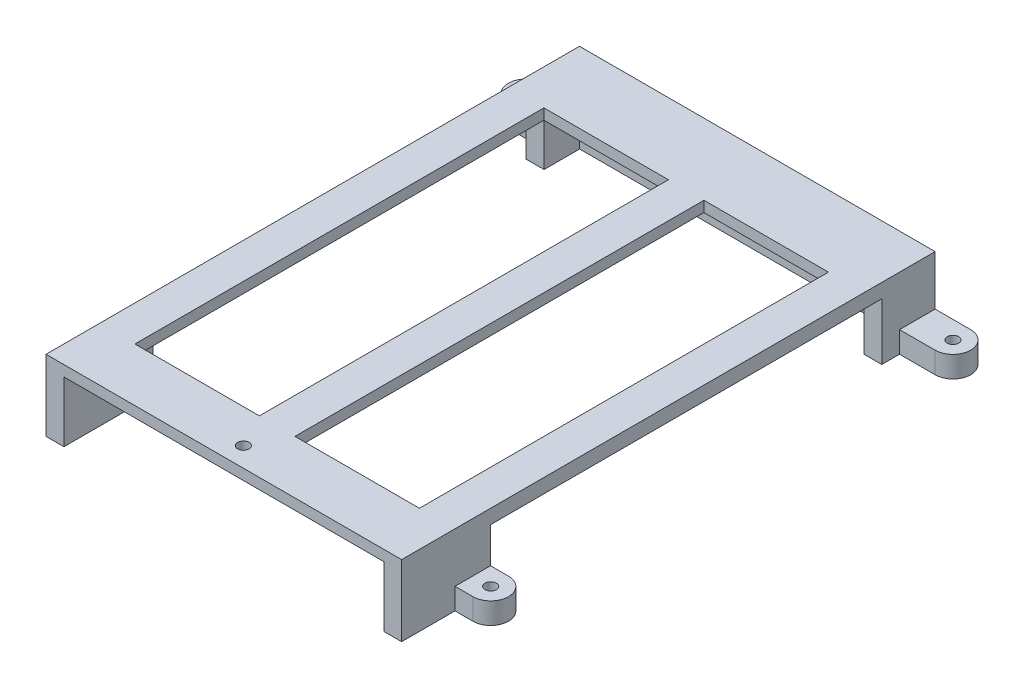
from build123d import *

# Parameters (mm, degrees)
SKETCH_2_W          = 100
SKETCH_2_H          = 40
EXTRUDE_1_DEPTH     = 150
SKETCH_3_W          = 90
SKETCH_3_H          = 32
CUT_EXTRUDE_1_DEPTH = 145
SKETCH_4_W          = 30
SKETCH_4_H          = 115
CUT_EXTRUDE_2_DEPTH = 20
SKETCH_5_W          = 35
SKETCH_5_H          = 115
CUT_EXTRUDE_3_DEPTH = 20
SKETCH_6_W          = 120
SKETCH_6_H          = 31
CUT_EXTRUDE_4_DEPTH = 207
SKETCH_7_R          = 1.5
CUT_EXTRUDE_5_DEPTH = 15
SKETCH_8_R          = 2.5
CUT_EXTRUDE_6_DEPTH = 15
SKETCH_10_W         = 4
SKETCH_10_H         = 18
EXTRUDE_2_DEPTH     = 5
SKETCH_11_W         = 100
SKETCH_11_H         = 150
CUT_EXTRUDE_7_DEPTH = 20
SKETCH_12_R         = 1.6
EXTRUDE_5_DEPTH     = 6
EXTRUDE_6_REACH     = 166.076
SKETCH_13_W         = 4.955411511
SKETCH_13_H         = 10
SKETCH_13_W_2       = 5.044588489
SKETCH_14_R         = 1.6
CUT_EXTRUDE_8_DEPTH = 10


with BuildPart() as part:
    # 草图2 → 凸台-拉伸1 (new body)
    with BuildSketch(Plane.XY):
        Rectangle(SKETCH_2_W, SKETCH_2_H)
    extrude(amount=EXTRUDE_1_DEPTH)

    # 草图3 → 切除-拉伸1 (cut)
    with BuildSketch(Plane.XY.offset(150)):
        with Locations((0.044588489, 1)):
            Rectangle(SKETCH_3_W, SKETCH_3_H)
    extrude(amount=-CUT_EXTRUDE_1_DEPTH, mode=Mode.SUBTRACT)

    # 草图4 → 切除-拉伸2 (cut)
    with BuildSketch(Plane.XZ.offset(20)):
        with Locations((-25, 77.5)):
            Rectangle(SKETCH_4_W, SKETCH_4_H)
        with Locations((25, 77.5)):
            Rectangle(SKETCH_4_W, SKETCH_4_H)
    extrude(amount=-CUT_EXTRUDE_2_DEPTH, mode=Mode.SUBTRACT)

    # 草图5 → 切除-拉伸3 (cut)
    with BuildSketch(Plane(origin=(0, 20, 0), x_dir=(1, 0, 0), z_dir=(0, 1, 0))):
        with Locations((-22.5, -77.5)):
            Rectangle(SKETCH_5_W, SKETCH_5_H)
        with Locations((22.5, -77.5)):
            Rectangle(SKETCH_5_W, SKETCH_5_H)
    extrude(amount=-CUT_EXTRUDE_3_DEPTH, mode=Mode.SUBTRACT)

    # 草图6 → 切除-拉伸4 (cut)
    with BuildSketch(Plane.ZY.offset(50)):
        with Locations((75, 0.5)):
            Rectangle(SKETCH_6_W, SKETCH_6_H)
    extrude(amount=-CUT_EXTRUDE_4_DEPTH, mode=Mode.SUBTRACT)

    # 草图7 → 切除-拉伸5 (cut)
    with BuildSketch(Plane.XZ.offset(20)):
        with Locations(Location((-5, 134, 0), (0, 0, 270))):
            Circle(SKETCH_7_R)
        with Locations(Location((5, 134, 0), (0, 0, 270))):
            Circle(SKETCH_7_R)
        with Locations(Location((5, 124, 0), (0, 0, 270))):
            Circle(SKETCH_7_R)
        with Locations(Location((-5, 124, 0), (0, 0, 270))):
            Circle(SKETCH_7_R)
    extrude(amount=-CUT_EXTRUDE_5_DEPTH, mode=Mode.SUBTRACT)

    # 草图8 → 切除-拉伸6 (cut)
    with BuildSketch(Plane.XZ.offset(20)):
        with Locations(Location((0, 129, 0), (0, 0, 270))):
            Circle(SKETCH_8_R)
    extrude(amount=-CUT_EXTRUDE_6_DEPTH, mode=Mode.SUBTRACT)

    # 草图10 → 凸台-拉伸2 (add)
    with BuildSketch(Plane.XZ.offset(20)):
        with Locations((-12, 126)):
            Rectangle(SKETCH_10_W, SKETCH_10_H)
        with Locations((12, 126)):
            Rectangle(SKETCH_10_W, SKETCH_10_H)
    extrude(amount=-EXTRUDE_2_DEPTH)

    # 草图11 → 切除-拉伸7 (cut)
    with BuildSketch(Plane.XZ.offset(20)):
        with Locations((0, 75)):
            Rectangle(SKETCH_11_W, SKETCH_11_H)
    extrude(amount=-CUT_EXTRUDE_7_DEPTH, mode=Mode.SUBTRACT)

    # 草图12 → 凸台-拉伸5 (add)
    # profile 1 of 4: a face of its own
    with BuildSketch(Plane.XZ):
        with BuildLine():
            Line((-44.955411511, 135), (-54.955411511, 135))
            ThreePointArc((-54.955411511, 135), (-59.955411511, 130), (-54.955411511, 125))
            Line((-54.955411511, 125), (-44.955411511, 125))
            Line((-44.955411511, 125), (-44.955411511, 135))
        make_face()
        with Locations(Location((-54.955411511, 130, 0), (0, 0, 270))):
            Circle(SKETCH_12_R, mode=Mode.SUBTRACT)
    # profile 2 of 4: a face of its own
    with BuildSketch(Plane.XZ):
        with BuildLine():
            Line((50, 0), (60, 0))
            ThreePointArc((60, 0), (65, 5), (60, 10))
            Line((60, 10), (50, 10))
            Line((50, 10), (50, 0))
        make_face()
        with Locations(Location((60, 5, 0), (0, 0, 270))):
            Circle(SKETCH_12_R, mode=Mode.SUBTRACT)
    # profile 3 of 4: a face of its own
    with BuildSketch(Plane.XZ):
        with BuildLine():
            Line((45.044588489, 135), (55.044588489, 135))
            ThreePointArc((55.044588489, 135), (60.044588489, 130), (55.044588489, 125))
            Line((55.044588489, 125), (45.044588489, 125))
            Line((45.044588489, 125), (45.044588489, 135))
        make_face()
        with Locations(Location((55.044588489, 130, 0), (0, 0, 270))):
            Circle(SKETCH_12_R, mode=Mode.SUBTRACT)
    # profile 4 of 4: a face of its own
    with BuildSketch(Plane.XZ):
        with BuildLine():
            Line((-50, 0), (-60, 0))
            ThreePointArc((-60, 0), (-65, 5), (-60, 10))
            Line((-60, 10), (-50, 10))
            Line((-50, 10), (-50, 0))
        make_face()
        with Locations(Location((-60, 5, 0), (0, 0, 270))):
            Circle(SKETCH_12_R, mode=Mode.SUBTRACT)
    extrude(amount=-EXTRUDE_5_DEPTH)

    # 草图13 → 凸台-拉伸6 (add, up to next)
    with BuildSketch(Plane(origin=(0, 6, 0), x_dir=(1, 0, 0), z_dir=(0, 1, 0)), mode=Mode.PRIVATE) as extrude_6_sk1:
        with Locations((47.522294245, -130)):
            Rectangle(SKETCH_13_W, SKETCH_13_H)
    extrude_6_tool1 = extrude(extrude_6_sk1.sketch, amount=EXTRUDE_6_REACH, mode=Mode.PRIVATE) - part.part
    # 草图13 → 凸台-拉伸6 (add, up to next)
    with BuildSketch(Plane(origin=(0, 6, 0), x_dir=(1, 0, 0), z_dir=(0, 1, 0)), mode=Mode.PRIVATE) as extrude_6_sk2:
        with Locations((-47.477705755, -130)):
            Rectangle(SKETCH_13_W_2, SKETCH_13_H)
    extrude_6_tool2 = extrude(extrude_6_sk2.sketch, amount=EXTRUDE_6_REACH, mode=Mode.PRIVATE) - part.part
    add(extrude_6_tool1.solids().sort_by_distance((47.522294, 6, 130))[0])
    add(extrude_6_tool2.solids().sort_by_distance((-47.477706, 6, 130))[0])

    # 草图14 → 切除-拉伸8 (cut)
    with BuildSketch(Plane(origin=(0, 20, 0), x_dir=(1, 0, 0), z_dir=(0, 1, 0))):
        with Locations(Location((0, -144.5, 0), (0, 0, 270))):
            Circle(SKETCH_14_R)
    extrude(amount=-CUT_EXTRUDE_8_DEPTH, mode=Mode.SUBTRACT)


solid = part.part
